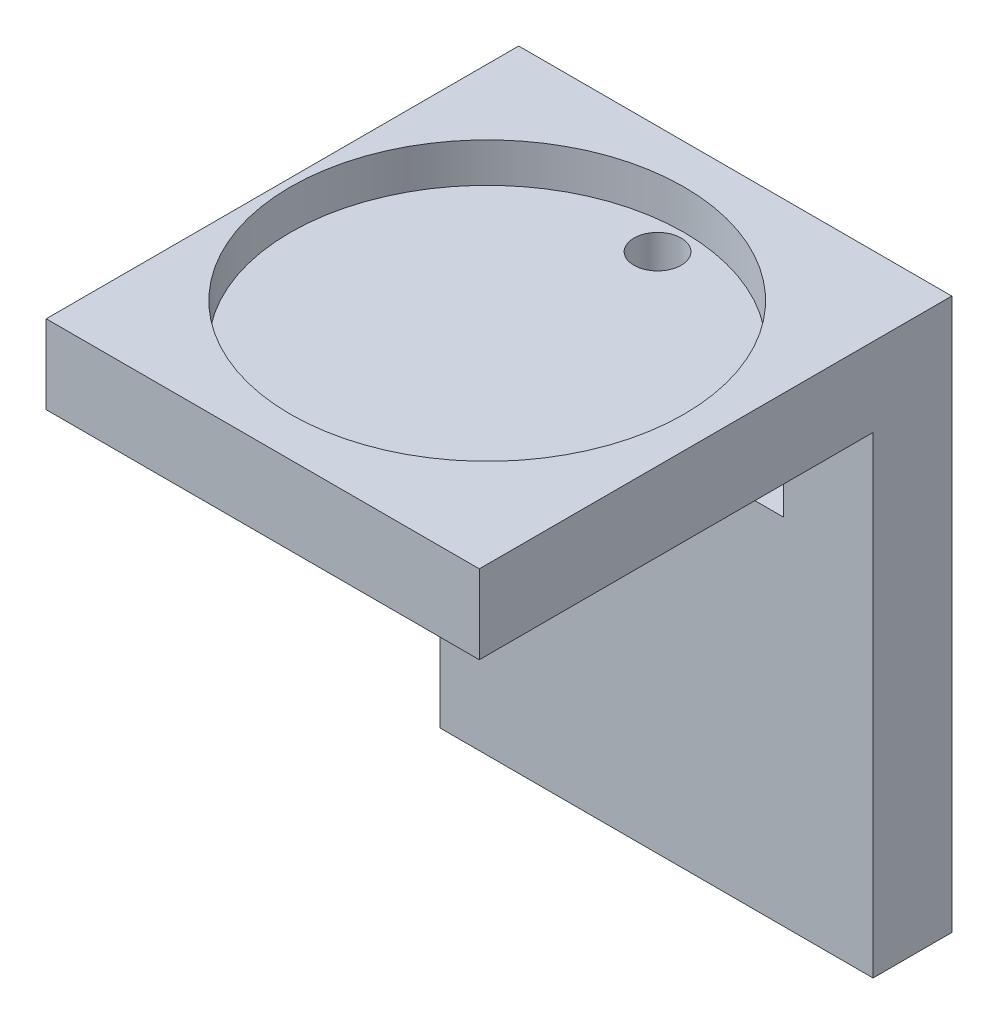
from build123d import *

# Parameters (mm, degrees)
SKETCH1_W                      = 670
SKETCH1_H                      = 120
BOSS_EXTRUDE1_DEPTH            = 530
SKETCH2_W                      = 100
SKETCH2_H                      = 200
SKETCH2_W_2                    = 650
SKETCH2_H_2                    = 250
CUT_EXTRUDE1_DEPTH             = 100
SKETCH3_R                      = 50
CUT_EXTRUDE2_DEPTH             = 260
F_12_0_12_DIAMETER_HOLE2_D     = 12
F_12_0_12_DIAMETER_HOLE2_DEPTH = 30
F_12_0_12_DIAMETER_HOLE2_TIP   = 3.605163714
SKETCH8_W                      = 650
SKETCH8_H                      = 50
BOSS_EXTRUDE2_DEPTH            = 5
SKETCH9_W                      = 10
SKETCH9_H                      = 250
CUT_EXTRUDE3_DEPTH             = 717
CUT_EXTRUDE4_DEPTH             = 5
SKETCH11_W                     = 10
SKETCH11_H                     = 100
BOSS_EXTRUDE3_DEPTH            = 78
BOSS_EXTRUDE3_2_DEPTH          = 78
BOSS_EXTRUDE3_3_DEPTH          = 78
SKETCH12_W                     = 20
SKETCH12_H                     = 30
CUT_EXTRUDE5_DEPTH             = 80
SKETCH15_W                     = 30
SKETCH15_H                     = 23.536156656
SKETCH15_H_2                   = 28.986603691
CUT_EXTRUDE7_DEPTH             = 35
SHELL1_T                       = -3
SKETCH16_W                     = 14
SKETCH16_H                     = 14
CUT_EXTRUDE8_DEPTH             = 35
SKETCH17_W                     = 5.729882812
SKETCH17_H                     = 17.428393554
SKETCH17_W_2                   = 13.369726562
SKETCH17_H_2                   = 3.342431641
BOSS_EXTRUDE4_DEPTH            = 5
CUT_EXTRUDE10_DEPTH            = 863.670273187
CUT_EXTRUDE10_DEPTH_BACK       = 863.670273187
SKETCH18_W                     = 670
SKETCH18_H                     = 250
CUT_EXTRUDE13_DEPTH            = 737.002717386
CUT_EXTRUDE13_DEPTH_BACK       = 737.002717386
SKETCH19_W                     = 228
SKETCH19_H                     = 280
SKETCH19_W_2                   = 332
CUT_EXTRUDE14_DEPTH            = 451.159971566
CUT_EXTRUDE14_DEPTH_BACK       = 451.159971566
SKETCH20_W                     = 110
SKETCH20_H                     = 140


with BuildPart() as part:
    # Sketch1 → Boss-Extrude1 (new body)
    with BuildSketch(Plane(origin=(0, 0, 0), x_dir=(1, 0, 0), z_dir=(0, 1, 0))):
        with Locations((335, 60)):
            Rectangle(SKETCH1_W, SKETCH1_H)
    extrude(amount=BOSS_EXTRUDE1_DEPTH)

    # Sketch2 → Cut-Extrude1 (cut)
    with BuildSketch(Plane.XY):
        with Locations((60, 380)):
            Rectangle(SKETCH2_W, SKETCH2_H)
        with Locations((170, 380)):
            Rectangle(SKETCH2_W, SKETCH2_H)
        with Locations((280, 380)):
            Rectangle(SKETCH2_W, SKETCH2_H)
        with Locations((390, 380)):
            Rectangle(SKETCH2_W, SKETCH2_H)
        with Locations((500, 380)):
            Rectangle(SKETCH2_W, SKETCH2_H)
        with Locations((610, 380)):
            Rectangle(SKETCH2_W, SKETCH2_H)
        with Locations((335, 135)):
            Rectangle(SKETCH2_W_2, SKETCH2_H_2)
    extrude(amount=-CUT_EXTRUDE1_DEPTH, mode=Mode.SUBTRACT)

    # Sketch3 → Cut-Extrude2 (cut)
    with BuildSketch(Plane(origin=(0, 530, 0), x_dir=(1, 0, 0), z_dir=(0, 1, 0))):
        with Locations((60, 60)):
            Circle(SKETCH3_R)
        with Locations((170, 60)):
            Circle(SKETCH3_R)
        with Locations((280, 60)):
            Circle(SKETCH3_R)
        with Locations((390, 60)):
            Circle(SKETCH3_R)
        with Locations((500, 60)):
            Circle(SKETCH3_R)
        with Locations((610, 60)):
            Circle(SKETCH3_R)
    extrude(amount=-CUT_EXTRUDE2_DEPTH, mode=Mode.SUBTRACT)

    # Ø12.0 (12) Diameter Hole2
    with Locations(Plane(origin=(59.704642413, 270, -102.411697903), x_dir=(0, 0, 1), z_dir=(0, 1, 0))):
        with Locations((0, 0), (-0.195888006, 111.8520513), (0.014838595, 221.167624818), (-0.341843303, 331.364008353), (0.657723149, 441.008646429), (1.288998006, 549.811854685)):
            Hole(F_12_0_12_DIAMETER_HOLE2_D / 2, depth=F_12_0_12_DIAMETER_HOLE2_DEPTH)
            with Locations((0, 0, -(F_12_0_12_DIAMETER_HOLE2_DEPTH + F_12_0_12_DIAMETER_HOLE2_TIP / 2))):  # 118° drill point
                Cone(0, F_12_0_12_DIAMETER_HOLE2_D / 2, F_12_0_12_DIAMETER_HOLE2_TIP, mode=Mode.SUBTRACT)

    # Sketch8 → Boss-Extrude2 (add)
    with BuildSketch(Plane.XY):
        with Locations((335, 305)):
            Rectangle(SKETCH8_W, SKETCH8_H)
    extrude(amount=-BOSS_EXTRUDE2_DEPTH)

    # Sketch9 → Cut-Extrude3 (cut)
    with BuildSketch(Plane(origin=(670, 0, 0), x_dir=(0, 0, -1), z_dir=(1, 0, 0))):
        with Locations((15, 135)):
            Rectangle(SKETCH9_W, SKETCH9_H)
    extrude(amount=-CUT_EXTRUDE3_DEPTH, mode=Mode.SUBTRACT)

    # Sketch10 → Cut-Extrude4 (cut)
    with BuildSketch(Plane(origin=(0, 10, 0), x_dir=(1, 0, 0), z_dir=(0, 1, 0))):
        Polygon((365, 61.943560596), (350, 87.924322709), (320, 87.924322709), (305, 61.943560596), (320, 35.962798482), (350, 35.962798482), align=None)
    extrude(amount=-CUT_EXTRUDE4_DEPTH, mode=Mode.SUBTRACT)

    # Sketch12 → Cut-Extrude5 (cut)
    with BuildSketch(Plane.XY.offset(-100)):
        with Locations((85.198613037, 245)):
            Rectangle(SKETCH12_W, SKETCH12_H)
        with Locations((195.198613037, 245)):
            Rectangle(SKETCH12_W, SKETCH12_H)
        with Locations((305.198613037, 245)):
            Rectangle(SKETCH12_W, SKETCH12_H)
        with Locations((415.198613037, 245)):
            Rectangle(SKETCH12_W, SKETCH12_H)
        with Locations((525.198613037, 245)):
            Rectangle(SKETCH12_W, SKETCH12_H)
        with Locations((635.198613037, 245)):
            Rectangle(SKETCH12_W, SKETCH12_H)
    extrude(amount=-CUT_EXTRUDE5_DEPTH, mode=Mode.SUBTRACT)

    # Sketch17 → Boss-Extrude4 (add)
    # profile 1 of 9: a face of its own
    with BuildSketch(Plane.XY):
        with BuildLine():
            Line((527.508830928, 289.835452458), (527.508830928, 307.263846012))
            Line((527.508830928, 307.263846012), (534.861434459, 307.263846012))
            add(Edge.make_bspline(
                [(534.861434459, 307.263846012), (535.181337774, 307.258256848), (535.803061116, 307.24739446), (536.703508491, 307.139069344), (537.544992916, 306.975202489), (538.325061607, 306.737496792), (539.040841948, 306.426020155), (539.698044515, 306.051894954), (540.290333057, 305.605079277), (540.822348212, 305.090232636), (541.284521701, 304.502523111), (541.692171296, 303.852565801), (542.030284458, 303.129762281), (542.309377095, 302.341316546), (542.5243908, 301.484161689), (542.679660381, 300.560045938), (542.773357357, 299.567500804), (542.783368073, 298.883107022), (542.788518428, 298.530997273)],
                knots=[0, 0, 0, 0, 1.135059408, 2.20595691, 3.214417064, 4.174978569, 5.094187092, 5.980001006, 6.853065862, 7.720814779, 8.600404634, 9.50058483, 10.438414914, 11.426825708, 12.465239141, 13.571113463, 14.750376389, 16, 16, 16, 16], degree=3))
            add(Edge.make_bspline(
                [(542.788518428, 298.530997273), (542.781740751, 298.180151665), (542.768592871, 297.499553336), (542.676885992, 296.511518461), (542.516733301, 295.591080531), (542.296748778, 294.736450427), (542.003051046, 293.953120444), (541.654236167, 293.233205539), (541.233025793, 292.585291498), (540.753136904, 292.000029304), (540.204772188, 291.484681411), (539.587651059, 291.044279297), (538.910779309, 290.668464036), (538.169670382, 290.361903209), (537.364073889, 290.124869172), (536.495133477, 289.954199984), (535.562644449, 289.853487388), (534.920131033, 289.841584621), (534.58911581, 289.835452458)],
                knots=[0, 0, 0, 0, 1.228418252, 2.382983832, 3.470276728, 4.496757894, 5.468023682, 6.394867725, 7.292157164, 8.167372942, 9.039072913, 9.918728341, 10.815246345, 11.744296628, 12.720973084, 13.750736166, 14.841206188, 16, 16, 16, 16], degree=3))
            Line((534.58911581, 289.835452458), (527.508830928, 289.835452458))
        make_face()
        with BuildLine():
            Line((533.238713741, 291.745413395), (534.048208904, 291.745413395))
            add(Edge.make_bspline(
                [(534.048208904, 291.745413395), (534.172894012, 291.749291978), (534.413033311, 291.756761998), (534.758676231, 291.825976613), (535.075745017, 291.938271137), (535.365749176, 292.094802589), (535.623404602, 292.300450923), (535.848862806, 292.551404902), (536.04776914, 292.844737637), (536.217685755, 293.190205032), (536.364284647, 293.596533622), (536.481764702, 294.076367921), (536.592118304, 294.630928744), (536.673672739, 295.265507643), (536.740044562, 295.978448886), (536.788346679, 296.768428292), (536.812018936, 297.636801208), (536.817188964, 298.241258393), (536.819890499, 298.55711002)],
                knots=[0, 0, 0, 0, 0.728710832, 1.403472396, 2.052289494, 2.690292559, 3.321919393, 3.970736491, 4.656696891, 5.388631723, 6.217040872, 7.17856157, 8.275589967, 9.523440737, 10.918935818, 12.463926104, 14.152268318, 16, 16, 16, 16], degree=3))
            add(Edge.make_bspline(
                [(536.819890499, 298.55711002), (536.8171426, 298.871715251), (536.811863063, 299.476166083), (536.7886758, 300.343334385), (536.739579947, 301.133216935), (536.674703848, 301.843934916), (536.589660404, 302.476324031), (536.488366458, 303.031681737), (536.362441588, 303.507627045), (536.222158727, 303.914921549), (536.050140993, 304.256514038), (535.858357073, 304.554097881), (535.62547107, 304.79746827), (535.36991257, 305.004888479), (535.079348843, 305.160875844), (534.761320266, 305.273944358), (534.414185903, 305.34216807), (534.172870641, 305.349893944), (534.048208904, 305.353885075)],
                knots=[0, 0, 0, 0, 1.842836665, 3.540640921, 5.080358154, 6.47765669, 7.719902824, 8.816971715, 9.781579111, 10.601733135, 11.334613876, 12.017393917, 12.666641099, 13.29908421, 13.937911793, 14.587567384, 15.270347425, 16, 16, 16, 16], degree=3))
            Line((534.048208904, 305.353885075), (533.238713741, 305.353885075))
            Line((533.238713741, 305.353885075), (533.238713741, 291.745413395))
        make_face(mode=Mode.SUBTRACT)
    # profile 2 of 9: a face of its own
    with BuildSketch(Plane.XY):
        with Locations((547.563420772, 298.549649235)):
            Rectangle(SKETCH17_W, SKETCH17_H)
    # profile 3 of 9: a face of its own
    with BuildSketch(Plane.XY):
        Polygon((564.514324092, 307.263846012), (564.514324092, 305.115139958), (558.545696163, 305.115139958), (558.545696163, 299.862747379), (563.559343624, 299.862747379), (563.559343624, 297.714041325), (558.545696163, 297.714041325), (558.545696163, 289.835452458), (552.81581335, 289.835452458), (552.81581335, 307.263846012), align=None)
    # profile 4 of 9: a face of its own
    with BuildSketch(Plane.XY):
        Polygon((577.645305538, 307.263846012), (577.645305538, 305.115139958), (571.676677608, 305.115139958), (571.676677608, 299.862747379), (576.690325069, 299.862747379), (576.690325069, 297.714041325), (571.676677608, 297.714041325), (571.676677608, 289.835452458), (565.946794795, 289.835452458), (565.946794795, 307.263846012), align=None)
    # profile 5 of 9: a face of its own
    with BuildSketch(Plane.XY):
        with Locations((584.330168819, 287.448001286)):
            Rectangle(SKETCH17_W_2, SKETCH17_H_2)
    # profile 6 of 9: a face of its own
    with BuildSketch(Plane.XY):
        with BuildLine():
            Line((605.578484249, 307.263846012), (605.578484249, 295.602639195))
            add(Edge.make_bspline(
                [(605.578484249, 295.602639195), (605.574209777, 295.35989389), (605.565919345, 294.889083964), (605.480877158, 294.20653885), (605.349958188, 293.569747554), (605.15926554, 292.978838165), (604.911867049, 292.436847071), (604.616163877, 291.936663973), (604.260702644, 291.487723021), (603.847299908, 291.08966617), (603.386881991, 290.731670113), (602.867295001, 290.425440037), (602.293741958, 290.168488385), (601.66690529, 289.960990771), (600.988052682, 289.797299786), (600.254912883, 289.679078851), (599.467035781, 289.60781007), (598.923618241, 289.60048219), (598.643684673, 289.59670734)],
                knots=[0, 0, 0, 0, 1.108173197, 2.149326602, 3.136215123, 4.073726706, 4.978516626, 5.852185058, 6.72141202, 7.584905625, 8.467554395, 9.379216169, 10.332422268, 11.332766067, 12.390653242, 13.518530507, 14.721707419, 16, 16, 16, 16], degree=3))
            add(Edge.make_bspline(
                [(598.643684673, 289.59670734), (598.373688491, 289.600411437), (597.851346557, 289.607577482), (597.093280473, 289.679448684), (596.387523889, 289.797736542), (595.733050135, 289.960122315), (595.130189942, 290.169220301), (594.579048171, 290.42623041), (594.078350789, 290.732835498), (593.633858028, 291.090104794), (593.234289459, 291.486851767), (592.899913678, 291.940746827), (592.609043638, 292.435866034), (592.375223767, 292.980322997), (592.191754821, 293.570441519), (592.063541006, 294.20666921), (591.983676196, 294.889343196), (591.974661767, 295.359932437), (591.970012569, 295.602639195)],
                knots=[0, 0, 0, 0, 1.258901956, 2.435505865, 3.547148904, 4.59359074, 5.576649289, 6.5183682, 7.424469602, 8.307507093, 9.172751023, 10.042627298, 10.928839176, 11.845659241, 12.799442865, 13.80597989, 14.868432463, 16, 16, 16, 16], degree=3))
            Line((591.970012569, 295.602639195), (591.970012569, 307.263846012))
            Line((591.970012569, 307.263846012), (597.699895381, 307.263846012))
            Line((597.699895381, 307.263846012), (597.699895381, 295.457153889))
            add(Edge.make_bspline(
                [(597.699895381, 295.457153889), (597.700816195, 295.287996189), (597.702584578, 294.963135903), (597.729908723, 294.499051493), (597.768241004, 294.079064133), (597.828226169, 293.705517832), (597.90066041, 293.377063412), (597.989882091, 293.09281535), (598.094998068, 292.852496478), (598.225239063, 292.654232043), (598.380826623, 292.495135011), (598.55368342, 292.353231761), (598.757556996, 292.238543846), (598.987648905, 292.146224908), (599.243380948, 292.070549638), (599.526120553, 292.020376099), (599.83553351, 291.990763905), (600.049971942, 291.986424568), (600.161954402, 291.984158512)],
                knots=[0, 0, 0, 0, 1.622370975, 3.115695595, 4.458049099, 5.666011203, 6.742434742, 7.681714947, 8.519814998, 9.250928664, 9.942747364, 10.646898194, 11.389596108, 12.175933929, 13.021386247, 13.943159715, 14.925891993, 16, 16, 16, 16], degree=3))
            add(Edge.make_bspline(
                [(600.161954402, 291.984158512), (600.283927219, 291.987190593), (600.521124756, 291.993087005), (600.86597014, 292.03390861), (601.187714881, 292.103380086), (601.484890424, 292.205377303), (601.758665297, 292.332852529), (602.012761516, 292.484567923), (602.236391413, 292.674631152), (602.439076761, 292.888441291), (602.620738276, 293.128529789), (602.771757722, 293.399928575), (602.905501548, 293.697121508), (603.005823683, 294.025060118), (603.089837826, 294.379999499), (603.146989706, 294.763086929), (603.186210275, 295.174074524), (603.189394751, 295.457053988), (603.191033077, 295.602639195)],
                knots=[0, 0, 0, 0, 1.083870311, 2.107775948, 3.08105344, 4.003637981, 4.893545291, 5.761570557, 6.624657808, 7.49233129, 8.376387281, 9.291996285, 10.246843261, 11.267344133, 12.334180325, 13.486053461, 14.706643157, 16, 16, 16, 16], degree=3))
            Line((603.191033077, 295.602639195), (603.191033077, 307.263846012))
            Line((603.191033077, 307.263846012), (605.578484249, 307.263846012))
        make_face()
    # profile 7 of 9: a face of its own
    with BuildSketch(Plane.XY):
        with BuildLine():
            Line((619.731593227, 302.015183827), (616.739818477, 301.526502415))
            add(Edge.make_bspline(
                [(616.739818477, 301.526502415), (616.748849224, 301.670726223), (616.765660669, 301.939210177), (616.78429066, 302.312269209), (616.796668381, 302.625642376), (616.798628236, 302.814722915), (616.799504756, 302.899286839)],
                knots=[0, 0, 0, 0, 1.261802504, 2.348944521, 3.261585937, 4, 4, 4, 4], degree=3))
            add(Edge.make_bspline(
                [(616.799504756, 302.899286839), (616.798306068, 303.007660677), (616.795968139, 303.219033721), (616.750451916, 303.523894877), (616.694806916, 303.811547356), (616.604352699, 304.076787391), (616.488181329, 304.320314265), (616.348943917, 304.543955606), (616.184187178, 304.745078709), (615.995833421, 304.928129987), (615.778009957, 305.083200131), (615.536269472, 305.218702836), (615.269765326, 305.333844758), (614.978065514, 305.431346685), (614.660683072, 305.504624438), (614.319025281, 305.556776695), (613.952471696, 305.585673441), (613.699597795, 305.590260771), (613.568984889, 305.592630192)],
                knots=[0, 0, 0, 0, 1.079280541, 2.105035848, 3.067950317, 3.99715044, 4.889989748, 5.753421302, 6.617030865, 7.476358039, 8.364190572, 9.274590025, 10.235106994, 11.254473582, 12.337095886, 13.478601727, 14.697662529, 16, 16, 16, 16], degree=3))
            add(Edge.make_bspline(
                [(613.568984889, 305.592630192), (613.391954632, 305.58912286), (613.059112606, 305.582528579), (612.595688488, 305.495339748), (612.198743126, 305.361419257), (611.87165349, 305.163811893), (611.613188167, 304.909795747), (611.433841092, 304.593316589), (611.323009072, 304.224665915), (611.313400221, 303.959558324), (611.308367061, 303.820693775)],
                knots=[0, 0, 0, 0, 1.294917039, 2.43462794, 3.440028966, 4.347597256, 5.210608309, 6.06356377, 6.985685997, 8, 8, 8, 8], degree=3))
            add(Edge.make_bspline(
                [(611.308367061, 303.820693775), (611.317562032, 303.705133219), (611.336106628, 303.472068433), (611.47315858, 303.132808312), (611.695999602, 302.811560885), (612.009295906, 302.510664216), (612.404107796, 302.221967273), (612.884407504, 301.948533431), (613.450813789, 301.688189695), (613.862519081, 301.536023727), (614.080048656, 301.455624958)],
                knots=[0, 0, 0, 0, 0.716839541, 1.445735977, 2.240793036, 3.131329288, 4.131129903, 5.273471266, 6.559404876, 8, 8, 8, 8], degree=3))
            add(Edge.make_bspline(
                [(614.080048656, 301.455624958), (614.335934702, 301.364918412), (614.834564244, 301.188164095), (615.547657928, 300.88707802), (616.213068388, 300.5749594), (616.829579094, 300.246613346), (617.397833174, 299.90520698), (617.914851624, 299.544556457), (618.386199073, 299.173962102), (618.807001026, 298.783874588), (619.177995113, 298.378100064), (619.4958685, 297.952745357), (619.771807525, 297.51723103), (619.991113975, 297.061458502), (620.169645242, 296.594624218), (620.292698657, 296.11024444), (620.364288243, 295.609761088), (620.37516617, 295.270864226), (620.380681514, 295.099036213)],
                knots=[0, 0, 0, 0, 1.359488612, 2.649152603, 3.874964776, 5.039588756, 6.146130126, 7.193090393, 8.194917302, 9.146793662, 10.063845301, 10.944476293, 11.803344532, 12.641736646, 13.473440096, 14.302714936, 15.139439897, 16, 16, 16, 16], degree=3))
            add(Edge.make_bspline(
                [(620.380681514, 295.099036213), (620.374476075, 294.902306495), (620.362285176, 294.515820995), (620.280160209, 293.948630617), (620.138011896, 293.409496554), (619.938489338, 292.895972278), (619.681049879, 292.411946655), (619.366518754, 291.954381076), (618.996510229, 291.525099427), (618.5710008, 291.128381035), (618.102222518, 290.765302239), (617.587803957, 290.450854345), (617.034458515, 290.187092261), (616.444107988, 289.968993032), (615.81453624, 289.801373099), (615.145337453, 289.685291013), (614.438790193, 289.606619894), (613.954683001, 289.600062276), (613.70700941, 289.59670734)],
                knots=[0, 0, 0, 0, 0.972121714, 1.909782367, 2.824924061, 3.721832975, 4.62620438, 5.527836938, 6.46026819, 7.421000932, 8.398101015, 9.385579713, 10.394244048, 11.422703992, 12.491421888, 13.608778581, 14.776629625, 16, 16, 16, 16], degree=3))
            add(Edge.make_bspline(
                [(613.70700941, 289.59670734), (613.445745367, 289.599650312), (612.939893069, 289.605348413), (612.207608113, 289.66709241), (611.525297432, 289.760984454), (610.893395078, 289.899706116), (610.309273131, 290.072394336), (609.776099392, 290.288320955), (609.295310255, 290.547303481), (608.863217672, 290.843007892), (608.478306623, 291.175775461), (608.148120946, 291.551766865), (607.86942369, 291.967163224), (607.639947144, 292.421521488), (607.466477665, 292.917583541), (607.339164663, 293.449829748), (607.264537999, 294.021332449), (607.254747521, 294.414908557), (607.249700069, 294.617815586)],
                knots=[0, 0, 0, 0, 1.342201143, 2.598733168, 3.773451092, 4.878874364, 5.91991243, 6.900006476, 7.829142054, 8.72062616, 9.585588575, 10.436728592, 11.283829734, 12.149664931, 13.044964919, 13.977937424, 14.957531465, 16, 16, 16, 16], degree=3))
            add(Edge.make_bspline(
                [(607.249700069, 294.617815586), (607.250803815, 294.692425759), (607.253213998, 294.855347393), (607.260452266, 295.122772538), (607.275636683, 295.433682216), (607.29037174, 295.656130545), (607.298195171, 295.774237248)],
                knots=[0, 0, 0, 0, 0.773500207, 1.689044709, 2.77302154, 4, 4, 4, 4], degree=3))
            Line((607.298195171, 295.774237248), (610.36457777, 296.337526509))
            add(Edge.make_bspline(
                [(610.36457777, 296.337526509), (610.326952988, 296.136337493), (610.255606535, 295.754830366), (610.178678473, 295.21219969), (610.124206629, 294.733311493), (610.11767002, 294.435147371), (610.114641475, 294.297001835)],
                knots=[0, 0, 0, 0, 1.192988372, 2.262218769, 3.194850416, 4, 4, 4, 4], degree=3))
            add(Edge.make_bspline(
                [(610.114641475, 294.297001835), (610.116191817, 294.183708768), (610.119182568, 293.965156219), (610.159053378, 293.648552813), (610.215988606, 293.352999663), (610.302906772, 293.079707227), (610.411206928, 292.826307836), (610.544682453, 292.59538211), (610.704385489, 292.386485019), (610.887496571, 292.200099922), (611.094689168, 292.033628705), (611.327456494, 291.892756696), (611.58347653, 291.771733922), (611.864681562, 291.677479524), (612.167961721, 291.596080628), (612.497219749, 291.548235723), (612.849461228, 291.512043782), (613.092629543, 291.508500084), (613.218327999, 291.506668278)],
                knots=[0, 0, 0, 0, 1.135776692, 2.191015738, 3.19649269, 4.151244236, 5.061952528, 5.956281389, 6.819534407, 7.692823504, 8.571441916, 9.478554956, 10.416037156, 11.406231466, 12.450054172, 13.561596327, 14.739541482, 16, 16, 16, 16], degree=3))
            add(Edge.make_bspline(
                [(613.218327999, 291.506668278), (613.423996012, 291.510791273), (613.810619321, 291.518541853), (614.349272542, 291.616708407), (614.810575885, 291.768742445), (615.189785268, 291.991387532), (615.490778961, 292.278756613), (615.698005174, 292.637320004), (615.824813318, 293.05638326), (615.837728413, 293.355975238), (615.844524288, 293.513619419)],
                knots=[0, 0, 0, 0, 1.308765556, 2.460272085, 3.475015317, 4.388076298, 5.239673503, 6.095681635, 6.997954785, 8, 8, 8, 8], degree=3))
            add(Edge.make_bspline(
                [(615.844524288, 293.513619419), (615.833808824, 293.638242951), (615.811807312, 293.894126055), (615.644884004, 294.264515838), (615.382382362, 294.620631473), (615.016807277, 294.962984909), (614.551376589, 295.293471235), (613.986957743, 295.616730224), (613.322148235, 295.933112033), (612.83677959, 296.119639164), (612.580430889, 296.21815395)],
                knots=[0, 0, 0, 0, 0.667930748, 1.371427933, 2.146459016, 3.034714139, 4.04893387, 5.207327294, 6.525042705, 8, 8, 8, 8], degree=3))
            add(Edge.make_bspline(
                [(612.580430889, 296.21815395), (612.374354345, 296.29679374), (611.970646869, 296.450850434), (611.394079385, 296.713586304), (610.853066711, 296.987016804), (610.357486361, 297.288235735), (609.896382561, 297.599610528), (609.477036946, 297.932256792), (609.09841673, 298.284556341), (608.758710772, 298.653375077), (608.457302107, 299.038989264), (608.199448649, 299.444659231), (607.977533299, 299.866789834), (607.798609588, 300.308107488), (607.65975715, 300.767821241), (607.559616231, 301.244439392), (607.497905054, 301.739995674), (607.491630423, 302.075933546), (607.488445186, 302.246468159)],
                knots=[0, 0, 0, 0, 1.249558333, 2.447906163, 3.58867143, 4.682264114, 5.731748367, 6.739728761, 7.711906036, 8.659384707, 9.578321416, 10.481344598, 11.379544271, 12.277135726, 13.175418307, 14.097160112, 15.034047388, 16, 16, 16, 16], degree=3))
            add(Edge.make_bspline(
                [(607.488445186, 302.246468159), (607.49282555, 302.439538736), (607.501402184, 302.817565692), (607.587451154, 303.36980586), (607.719291893, 303.894921371), (607.910558542, 304.389343064), (608.156192894, 304.852853762), (608.453187669, 305.288766511), (608.804241719, 305.697593471), (609.213503754, 306.066686531), (609.657214714, 306.407618241), (610.14376173, 306.697651931), (610.658716537, 306.950861947), (611.210636666, 307.148827868), (611.791820619, 307.313252612), (612.408080529, 307.421140415), (613.056315391, 307.490701612), (613.499160755, 307.498567824), (613.725661373, 307.502591129)],
                knots=[0, 0, 0, 0, 1.01033566, 1.978209831, 2.919499157, 3.840961976, 4.746855014, 5.660740114, 6.597989116, 7.56120833, 8.541877795, 9.523498025, 10.522416858, 11.542172371, 12.589598349, 13.681636521, 14.814234488, 16, 16, 16, 16], degree=3))
            add(Edge.make_bspline(
                [(613.725661373, 307.502591129), (613.968269855, 307.498219033), (614.438190994, 307.489750488), (615.120391152, 307.426787419), (615.755073228, 307.319142339), (616.345153155, 307.171557286), (616.887304575, 306.977590666), (617.384933999, 306.742393454), (617.834452216, 306.46201507), (618.236961315, 306.139451502), (618.593086714, 305.773322851), (618.897467704, 305.361641069), (619.158701245, 304.909408454), (619.366684143, 304.412232174), (619.529870326, 303.873247147), (619.649133834, 303.29158184), (619.720420497, 302.667301443), (619.72779778, 302.236712324), (619.731593227, 302.015183827)],
                knots=[0, 0, 0, 0, 1.248314423, 2.417925914, 3.521398822, 4.558068205, 5.543720209, 6.479599284, 7.385061127, 8.263440163, 9.127722873, 10.00561236, 10.891325273, 11.808802823, 12.772251995, 13.784947978, 14.860405143, 16, 16, 16, 16], degree=3))
        make_face()
    # profile 8 of 9: a face of its own
    with BuildSketch(Plane.XY):
        Polygon((633.989153194, 307.263846012), (633.989153194, 305.115139958), (628.020525264, 305.115139958), (628.020525264, 300.340237614), (633.034172725, 300.340237614), (633.034172725, 298.191531559), (628.020525264, 298.191531559), (628.020525264, 291.984158512), (634.944133663, 291.984158512), (634.944133663, 289.835452458), (622.290642452, 289.835452458), (622.290642452, 307.263846012), align=None)
    # profile 9 of 9: a face of its own
    with BuildSketch(Plane.XY):
        with BuildLine():
            Line((636.376604366, 289.835452458), (636.376604366, 307.263846012))
            Line((636.376604366, 307.263846012), (643.990335369, 307.263846012))
            add(Edge.make_bspline(
                [(643.990335369, 307.263846012), (644.237946498, 307.261150834), (644.721600887, 307.25588639), (645.426490561, 307.189203683), (646.094808274, 307.090496236), (646.724915796, 306.949857504), (647.317873659, 306.767252686), (647.871119087, 306.542146), (648.390701058, 306.282329135), (648.864494846, 305.976472528), (649.295093616, 305.642889252), (649.669668547, 305.279483604), (649.990389523, 304.894749072), (650.250664962, 304.483256345), (650.454275633, 304.048690948), (650.59581384, 303.587791605), (650.684089268, 303.104102537), (650.695510601, 302.772834174), (650.701311397, 302.604585835)],
                knots=[0, 0, 0, 0, 1.303269877, 2.545653735, 3.724355284, 4.8584284, 5.941462088, 6.987020715, 8.000098032, 8.995332524, 9.951400474, 10.863507538, 11.737823931, 12.582415999, 13.420128714, 14.25671499, 15.114600608, 16, 16, 16, 16], degree=3))
            add(Edge.make_bspline(
                [(650.701311397, 302.604585835), (650.698282873, 302.472674957), (650.692382063, 302.215658276), (650.651041486, 301.838684287), (650.580643818, 301.480313933), (650.481036683, 301.139915259), (650.347814833, 300.820175594), (650.191279492, 300.517863507), (650.009772227, 300.230553342), (649.788675198, 299.970497982), (649.548268341, 299.722842359), (649.274558803, 299.497116911), (648.974487035, 299.288655528), (648.642526299, 299.104010513), (648.287619671, 298.928055749), (647.899038177, 298.784921972), (647.486819978, 298.644749395), (647.19793098, 298.577036306), (647.049257183, 298.54218845)],
                knots=[0, 0, 0, 0, 1.057156483, 2.059775939, 3.035078039, 3.981068617, 4.897189472, 5.80650904, 6.70770952, 7.613691521, 8.536886357, 9.470937334, 10.45233069, 11.461024139, 12.51295332, 13.623444893, 14.776929983, 16, 16, 16, 16], degree=3))
            add(Edge.make_bspline(
                [(647.049257183, 298.54218845), (647.19164695, 298.499279419), (647.467865022, 298.416041346), (647.856360945, 298.265600017), (648.211652989, 298.111536308), (648.524185739, 297.936781388), (648.807636894, 297.762122504), (649.047122259, 297.564301324), (649.255235567, 297.361673563), (649.425188343, 297.135464734), (649.570253643, 296.882344437), (649.694827156, 296.586596707), (649.815179167, 296.247423665), (649.917667348, 295.859098311), (650.004750555, 295.423699276), (650.088222437, 294.944027189), (650.153853601, 294.416024546), (650.187587341, 294.048412906), (650.2051692, 293.856815525)],
                knots=[0, 0, 0, 0, 1.149282524, 2.229462177, 3.219229774, 4.139917433, 4.995948464, 5.788695735, 6.536448429, 7.236319808, 7.968460079, 8.78645307, 9.713791991, 10.749194692, 11.887975363, 13.146018663, 14.512518948, 16, 16, 16, 16], degree=3))
            add(Edge.make_bspline(
                [(650.2051692, 293.856815525), (650.225980287, 293.627849833), (650.265975604, 293.187817268), (650.348933081, 292.554613589), (650.44386163, 291.974357025), (650.555874504, 291.44528724), (650.681301216, 290.967898855), (650.821280597, 290.540469593), (650.979920039, 290.165788217), (651.10484481, 289.941461656), (651.163880062, 289.835452458)],
                knots=[0, 0, 0, 0, 1.324580516, 2.545615266, 3.678710841, 4.711533017, 5.660403917, 6.521349952, 7.301239649, 8, 8, 8, 8], degree=3))
            Line((651.163880062, 289.835452458), (645.213904094, 289.835452458))
            add(Edge.make_bspline(
                [(645.213904094, 289.835452458), (645.12229736, 290.069847279), (644.935171241, 290.548648246), (644.7595281, 291.319414791), (644.64846922, 292.142514735), (644.635117598, 292.70994511), (644.628232479, 293.002555653)],
                knots=[0, 0, 0, 0, 0.930410518, 1.900560147, 2.917368081, 4, 4, 4, 4], degree=3))
            Line((644.628232479, 293.002555653), (644.605850124, 294.002300831))
            Line((644.605850124, 294.002300831), (644.579737377, 295.266903874))
            add(Edge.make_bspline(
                [(644.579737377, 295.266903874), (644.573694669, 295.477395004), (644.562357007, 295.872330118), (644.469348432, 296.426164013), (644.30178735, 296.894645884), (644.073222546, 297.287223005), (643.766741442, 297.590613479), (643.39104803, 297.804152917), (642.950456912, 297.93396284), (642.634664848, 297.946292392), (642.468335247, 297.952786442)],
                knots=[0, 0, 0, 0, 1.295300309, 2.430314163, 3.439929415, 4.342995669, 5.203512789, 6.060756153, 6.978588463, 8, 8, 8, 8], degree=3))
            Line((642.468335247, 297.952786442), (642.106487178, 297.952786442))
            Line((642.106487178, 297.952786442), (642.106487178, 289.835452458))
            Line((642.106487178, 289.835452458), (636.376604366, 289.835452458))
        make_face()
        with BuildLine():
            Line((642.106487178, 299.862747379), (642.617550945, 299.862747379))
            add(Edge.make_bspline(
                [(642.617550945, 299.862747379), (642.722054451, 299.865172716), (642.925280724, 299.869889229), (643.220054897, 299.898289891), (643.494111408, 299.951809873), (643.749840966, 300.021017819), (643.984372137, 300.114851792), (644.200147241, 300.225818296), (644.391160406, 300.362685327), (644.565327067, 300.516342321), (644.718148635, 300.691986294), (644.850351299, 300.889034217), (644.961199162, 301.106225057), (645.056078491, 301.342818683), (645.125883912, 301.600830857), (645.173262731, 301.879472914), (645.203404658, 302.177423605), (645.207875435, 302.383174491), (645.210173702, 302.488943669)],
                knots=[0, 0, 0, 0, 1.184986479, 2.304423995, 3.352332712, 4.347714965, 5.303263624, 6.211353909, 7.091434645, 7.960150225, 8.839440182, 9.723126897, 10.64371617, 11.599264829, 12.608232147, 13.667459739, 14.800924404, 16, 16, 16, 16], degree=3))
            add(Edge.make_bspline(
                [(645.210173702, 302.488943669), (645.207875435, 302.594712847), (645.203404658, 302.800463732), (645.173262731, 303.098414423), (645.125883912, 303.37705648), (645.056078491, 303.635068654), (644.961199162, 303.87166228), (644.850351299, 304.08885312), (644.718148635, 304.285901043), (644.565327067, 304.461545017), (644.391160406, 304.61520201), (644.200147241, 304.752069041), (643.984372137, 304.863035546), (643.749840966, 304.956869518), (643.494111408, 305.026077464), (643.220054897, 305.079597446), (642.925280724, 305.107998108), (642.722054451, 305.112714621), (642.617550945, 305.115139958)],
                knots=[0, 0, 0, 0, 1.199075596, 2.332540261, 3.391767853, 4.400735171, 5.35628383, 6.276873103, 7.160559818, 8.039849775, 8.908565355, 9.788646091, 10.696736376, 11.652285035, 12.647667288, 13.695576005, 14.815013521, 16, 16, 16, 16], degree=3))
            Line((642.617550945, 305.115139958), (642.106487178, 305.115139958))
            Line((642.106487178, 305.115139958), (642.106487178, 299.862747379))
        make_face(mode=Mode.SUBTRACT)
    extrude(amount=BOSS_EXTRUDE4_DEPTH)

    # Sketch18 → Cut-Extrude10 (cut, two sides: drawn at the far end of the back side and taken through both)
    with BuildSketch(Plane.XY.offset(-CUT_EXTRUDE10_DEPTH_BACK)):
        with Locations((335, 405)):
            Rectangle(SKETCH18_W, SKETCH18_H)
    extrude(amount=CUT_EXTRUDE10_DEPTH + CUT_EXTRUDE10_DEPTH_BACK, mode=Mode.SUBTRACT)

    # Sketch19 → Cut-Extrude13 (cut, two sides: drawn at the far end of the back side and taken through both)
    with BuildSketch(Plane(origin=(0, 0, -120), x_dir=(-1, 0, 0), z_dir=(0, 0, -1)).offset(-CUT_EXTRUDE13_DEPTH_BACK)):
        with Locations((-114, 140)):
            Rectangle(SKETCH19_W, SKETCH19_H)
        with Locations((-504, 140)):
            Rectangle(SKETCH19_W_2, SKETCH19_H)
    extrude(amount=CUT_EXTRUDE13_DEPTH + CUT_EXTRUDE13_DEPTH_BACK, mode=Mode.SUBTRACT)

    # Sketch20 → Cut-Extrude14 (cut, two sides: drawn at the far end of the back side and taken through both)
    with BuildSketch(Plane.XY.offset(-100).offset(-CUT_EXTRUDE14_DEPTH_BACK)):
        with Locations((283, 70)):
            Rectangle(SKETCH20_W, SKETCH20_H)
    extrude(amount=CUT_EXTRUDE14_DEPTH + CUT_EXTRUDE14_DEPTH_BACK, mode=Mode.SUBTRACT)


with BuildPart() as body_2:
    # Sketch11 → Boss-Extrude3 (new body)
    with BuildSketch(Plane.XY.offset(-100)):
        with Locations((255, 60)):
            Rectangle(SKETCH11_W, SKETCH11_H)
    extrude(amount=BOSS_EXTRUDE3_DEPTH)


with BuildPart() as body_3:
    # Sketch11 → Boss-Extrude3 2 (new body)
    with BuildSketch(Plane.XY.offset(-100)):
        with Locations((415, 60)):
            Rectangle(SKETCH11_W, SKETCH11_H)
    extrude(amount=BOSS_EXTRUDE3_2_DEPTH)


with BuildPart() as body_4:
    # Sketch11 → Boss-Extrude3 3 (new body)
    with BuildSketch(Plane.XY.offset(-100)):
        Polygon((25, 198.45686471), (325, 145.558770497), (325, 122.01775856), (345, 122.01775856), (345, 145.558770497), (645, 198.45686471), align=None)
    extrude(amount=BOSS_EXTRUDE3_3_DEPTH)

    # Sketch15 → Cut-Extrude7 (cut)
    with BuildSketch(Plane(origin=(345, 0, 0), x_dir=(0, 0, -1), z_dir=(1, 0, 0))):
        with Locations((35, 133.231921672)):
            Rectangle(SKETCH15_W, SKETCH15_H)
        with Locations((85, 130.506698154)):
            Rectangle(SKETCH15_W, SKETCH15_H_2)
    extrude(amount=-CUT_EXTRUDE7_DEPTH, mode=Mode.SUBTRACT)

    # Shell1
    shell1_openings = [body_4.faces().sort_by_distance(p)[0] for p in [
        (335, 198.45686471, -61),
    ]]
    offset(amount=SHELL1_T, openings=shell1_openings, kind=Kind.INTERSECTION)

    # Sketch16 → Cut-Extrude8 (cut)
    with BuildSketch(Plane.XZ.offset(-122.01775856)):
        with Locations((335, -60)):
            Rectangle(SKETCH16_W, SKETCH16_H)
    extrude(amount=-CUT_EXTRUDE8_DEPTH, mode=Mode.SUBTRACT)


solid = part.part
